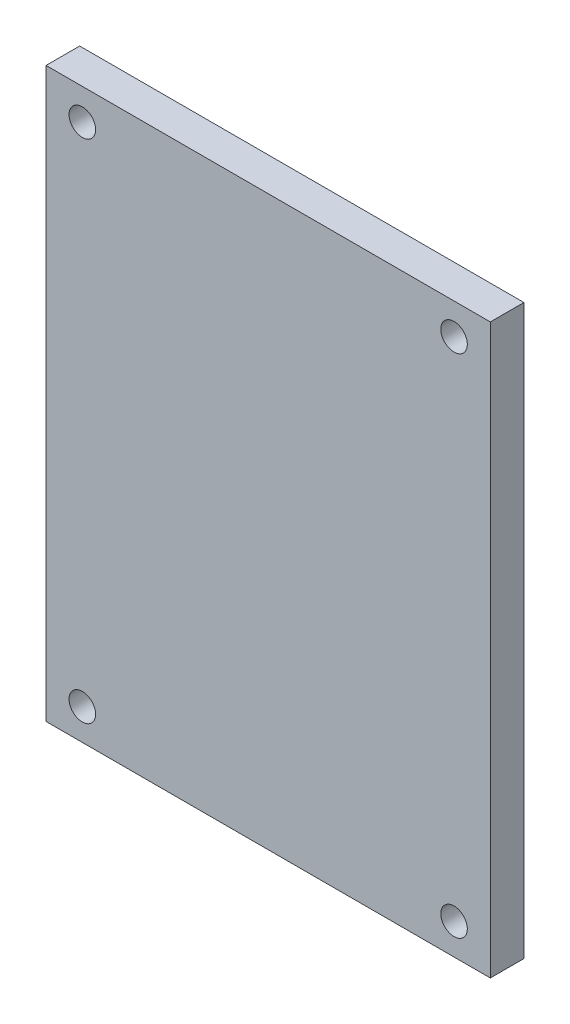
from build123d import *

# Parameters (mm, degrees)
SKETCH1_W           = 63.754
SKETCH1_H           = 81.534
SKETCH1_R           = 1.905
BOSS_EXTRUDE1_DEPTH = 4.826


with BuildPart() as part:
    # Sketch1 → Boss-Extrude1 (new body)
    with BuildSketch(Plane.XY):
        with Locations((31.877, 40.767)):
            Rectangle(SKETCH1_W, SKETCH1_H)
        with Locations((5.207, 77.089)):
            Circle(SKETCH1_R, mode=Mode.SUBTRACT)
        with Locations((58.547, 77.089)):
            Circle(SKETCH1_R, mode=Mode.SUBTRACT)
        with Locations((5.207, 4.445)):
            Circle(SKETCH1_R, mode=Mode.SUBTRACT)
        with Locations((58.547, 4.445)):
            Circle(SKETCH1_R, mode=Mode.SUBTRACT)
    extrude(amount=BOSS_EXTRUDE1_DEPTH)


solid = part.part
